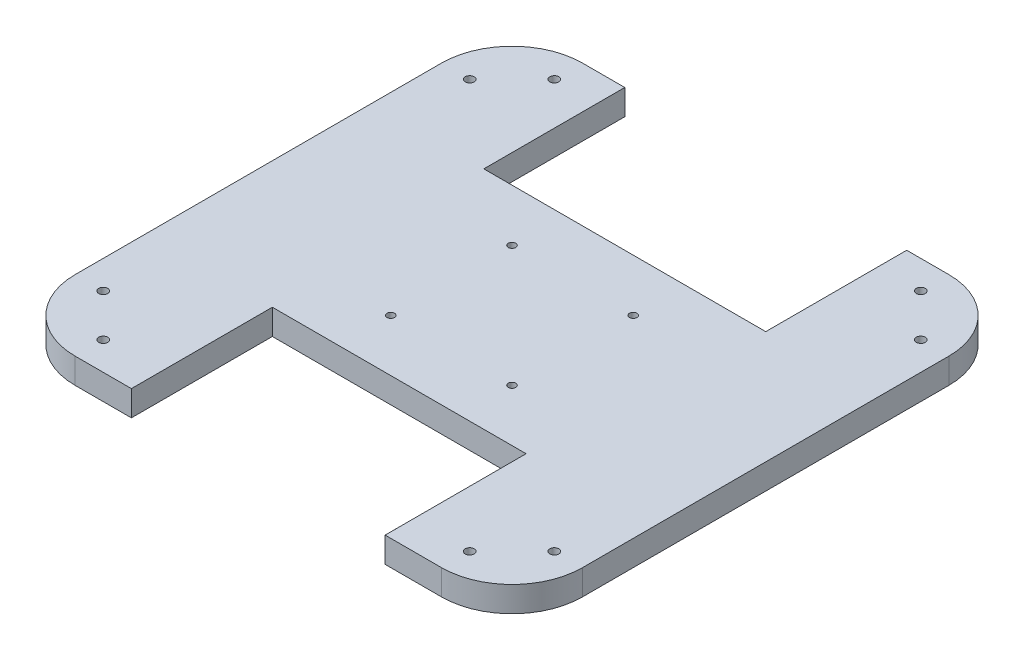
from build123d import *

# Parameters (mm, degrees)
PLATE_DEPTH        = 9
SKETCH3_R          = 1.6
HEX_HOLES_DEPTH    = 128.597021909
SKETCH4_R          = 1.325
LIDAR_HOLES_DEPTH  = 128.597021909
SKETCH5_W          = 100
SKETCH5_H          = 50
SKETCH5_W_2        = 90
CUT_EXTRUDE1_DEPTH = 128.597021909
SKETCH6_R          = 3.5
CUT_EXTRUDE2_DEPTH = 5


with BuildPart() as part:
    # Sketch1 → Plate (new body)
    with BuildSketch(Plane(origin=(0, 0, 0), x_dir=(1, 0, 0), z_dir=(0, 1, 0))):
        with BuildLine():
            Line((-65, -90), (65, -90))
            ThreePointArc((65, -90), (82.67766953, -82.67766953), (90, -65))
            Line((90, -65), (90, 65))
            ThreePointArc((90, 65), (82.67766953, 82.67766953), (65, 90))
            Line((65, 90), (-65, 90))
            ThreePointArc((-65, 90), (-82.67766953, 82.67766953), (-90, 65))
            Line((-90, 65), (-90, -65))
            ThreePointArc((-90, -65), (-82.67766953, -82.67766953), (-65, -90))
        make_face()
    extrude(amount=PLATE_DEPTH)

    # Sketch3 → Hex Holes (cut, through all)
    with BuildSketch(Plane(origin=(0, 9, 0), x_dir=(1, 0, 0), z_dir=(0, 1, 0))):
        with Locations(Location((-65, 80, 0), (0, 0, 270))):
            Circle(SKETCH3_R)
        with Locations(Location((-80, 65, 0), (0, 0, 270))):
            Circle(SKETCH3_R)
        with Locations(Location((80, 65, 0), (0, 0, 270))):
            Circle(SKETCH3_R)
        with Locations(Location((80, -65, 0), (0, 0, 270))):
            Circle(SKETCH3_R)
        with Locations(Location((65, 80, 0), (0, 0, 270))):
            Circle(SKETCH3_R)
        with Locations(Location((65, -80, 0), (0, 0, 270))):
            Circle(SKETCH3_R)
        with Locations(Location((-65, -80, 0), (0, 0, 270))):
            Circle(SKETCH3_R)
        with Locations(Location((-80, -65, 0), (0, 0, 270))):
            Circle(SKETCH3_R)
    extrude(amount=-HEX_HOLES_DEPTH, mode=Mode.SUBTRACT)

    # Sketch4 → LiDAR Holes (cut, through all)
    with BuildSketch(Plane(origin=(0, 9, 0), x_dir=(1, 0, 0), z_dir=(0, 1, 0))):
        with Locations(Location((-21.5, 21.5, 0), (0, 0, 270))):
            Circle(SKETCH4_R)
        with Locations(Location((21.5, 21.5, 0), (0, 0, 270))):
            Circle(SKETCH4_R)
        with Locations(Location((21.5, -21.5, 0), (0, 0, 270))):
            Circle(SKETCH4_R)
        with Locations(Location((-21.5, -21.5, 0), (0, 0, 270))):
            Circle(SKETCH4_R)
    extrude(amount=-LIDAR_HOLES_DEPTH, mode=Mode.SUBTRACT)

    # Sketch5 → Cut-Extrude1 (cut, through all)
    with BuildSketch(Plane(origin=(0, 9, 0), x_dir=(1, 0, 0), z_dir=(0, 1, 0))):
        with Locations((0, 65)):
            Rectangle(SKETCH5_W, SKETCH5_H)
        with Locations((0, -65)):
            Rectangle(SKETCH5_W_2, SKETCH5_H)
    extrude(amount=-CUT_EXTRUDE1_DEPTH, mode=Mode.SUBTRACT)

    # Sketch6 → Cut-Extrude2 (cut)
    with BuildSketch(Plane.XZ):
        with Locations(Location((-21.5, 21.5, 0), (0, 0, 270))):
            Circle(SKETCH6_R)
        with Locations(Location((21.5, 21.5, 0), (0, 0, 270))):
            Circle(SKETCH6_R)
        with Locations(Location((-21.5, -21.5, 0), (0, 0, 270))):
            Circle(SKETCH6_R)
        with Locations(Location((21.5, -21.5, 0), (0, 0, 270))):
            Circle(SKETCH6_R)
    extrude(amount=-CUT_EXTRUDE2_DEPTH, mode=Mode.SUBTRACT)


solid = part.part
